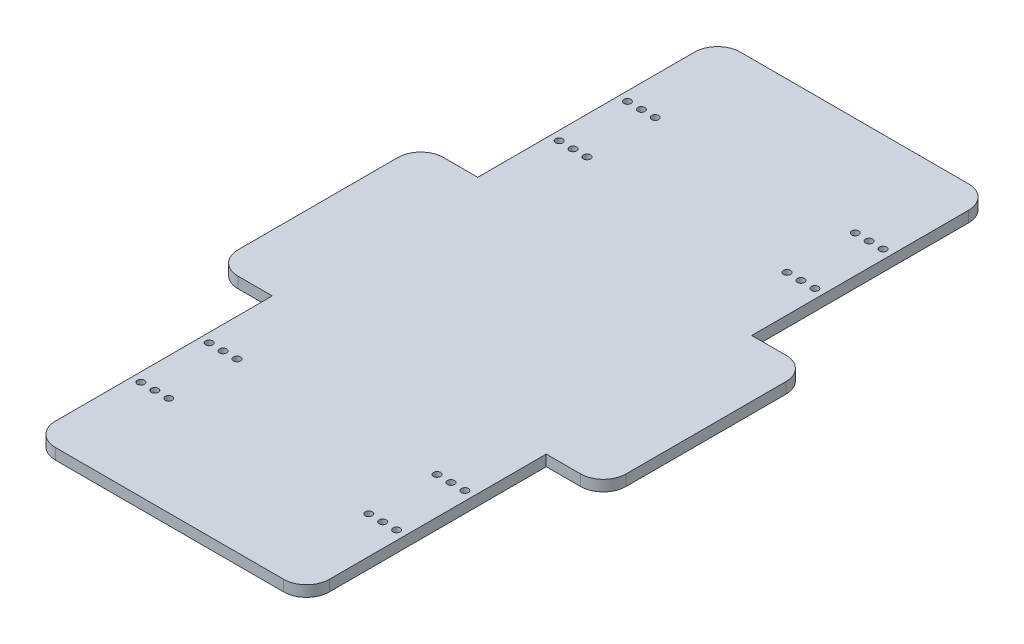
from build123d import *

# Parameters (mm, degrees)
BOSS_EXTRUDE1_DEPTH     = 4.8
SKETCH2_R               = 1.55
CUT_EXTRUDE1_DEPTH      = 4.8
MIRROR2_COPY_1_SKETCH_R = 1.55
MIRROR2_COPY_1_DEPTH    = 4.8
FILLET1_R               = 10


with BuildPart() as part:
    # Sketch1 → Boss-Extrude1 (new body)
    with BuildSketch(Plane(origin=(0, 0, 0), x_dir=(1, 0, 0), z_dir=(0, 1, 0))):
        Polygon((60, 150), (-60, 150), (-60, 45), (-85, 45), (-85, -45), (-60, -45), (-60, -150), (60, -150), (60, -45), (85, -45), (85, 45), (60, 45), align=None)
    extrude(amount=BOSS_EXTRUDE1_DEPTH)

    # Sketch2 → Cut-Extrude1 (cut)
    with BuildSketch(Plane(origin=(0, 4.8, 0), x_dir=(1, 0, 0), z_dir=(0, 1, 0))):
        with Locations(Location((56.003512962, -76.642970185, 0), (0, 0, 270))):
            Circle(SKETCH2_R)
        with Locations(Location((49.903512962, -76.642970185, 0), (0, 0, 270))):
            Circle(SKETCH2_R)
        with Locations(Location((56.003512962, -106.542970185, 0), (0, 0, 270))):
            Circle(SKETCH2_R)
        with Locations(Location((49.903512962, -106.542970185, 0), (0, 0, 270))):
            Circle(SKETCH2_R)
        with Locations(Location((43.803512962, -76.642970185, 0), (0, 0, 270))):
            Circle(SKETCH2_R)
        with Locations(Location((43.803512962, -106.542970185, 0), (0, 0, 270))):
            Circle(SKETCH2_R)
    cut_extrude1 = extrude(amount=-CUT_EXTRUDE1_DEPTH, mode=Mode.SUBTRACT)

    # Mirror1: Cut-Extrude1 across plane
    add(cut_extrude1.mirror(Plane(origin=(0, 0, 0), x_dir=(0, 0, 1), z_dir=(1, 0, 0))), mode=Mode.SUBTRACT)

    # Mirror2: Cut-Extrude1 across plane
    add(cut_extrude1.mirror(Plane.XY), mode=Mode.SUBTRACT)

    # Mirror2 copy 1 sketch → Mirror2 copy 1 (cut)
    with BuildSketch(Plane(origin=(0, 4.8, 0), x_dir=(-1, 0, 0), z_dir=(0, 1, 0))):
        with Locations(Location((56.003512962, -76.642970185, 0), (0, 0, 270))):
            Circle(MIRROR2_COPY_1_SKETCH_R)
        with Locations(Location((49.903512962, -76.642970185, 0), (0, 0, 270))):
            Circle(MIRROR2_COPY_1_SKETCH_R)
        with Locations(Location((56.003512962, -106.542970185, 0), (0, 0, 270))):
            Circle(MIRROR2_COPY_1_SKETCH_R)
        with Locations(Location((49.903512962, -106.542970185, 0), (0, 0, 270))):
            Circle(MIRROR2_COPY_1_SKETCH_R)
        with Locations(Location((43.803512962, -76.642970185, 0), (0, 0, 270))):
            Circle(MIRROR2_COPY_1_SKETCH_R)
        with Locations(Location((43.803512962, -106.542970185, 0), (0, 0, 270))):
            Circle(MIRROR2_COPY_1_SKETCH_R)
    extrude(amount=-MIRROR2_COPY_1_DEPTH, mode=Mode.SUBTRACT)

    # Fillet1
    fillet1_edges = [part.edges().sort_by_distance(p)[0] for p in [
        (85, 2.4, -45),
        (85, 2.4, 45),
        (60, 2.4, 150),
        (-60, 2.4, 150),
        (-85, 2.4, 45),
        (-85, 2.4, -45),
        (-60, 2.4, -150),
        (60, 2.4, -150),
    ]]
    fillet(fillet1_edges, radius=FILLET1_R)


solid = part.part
